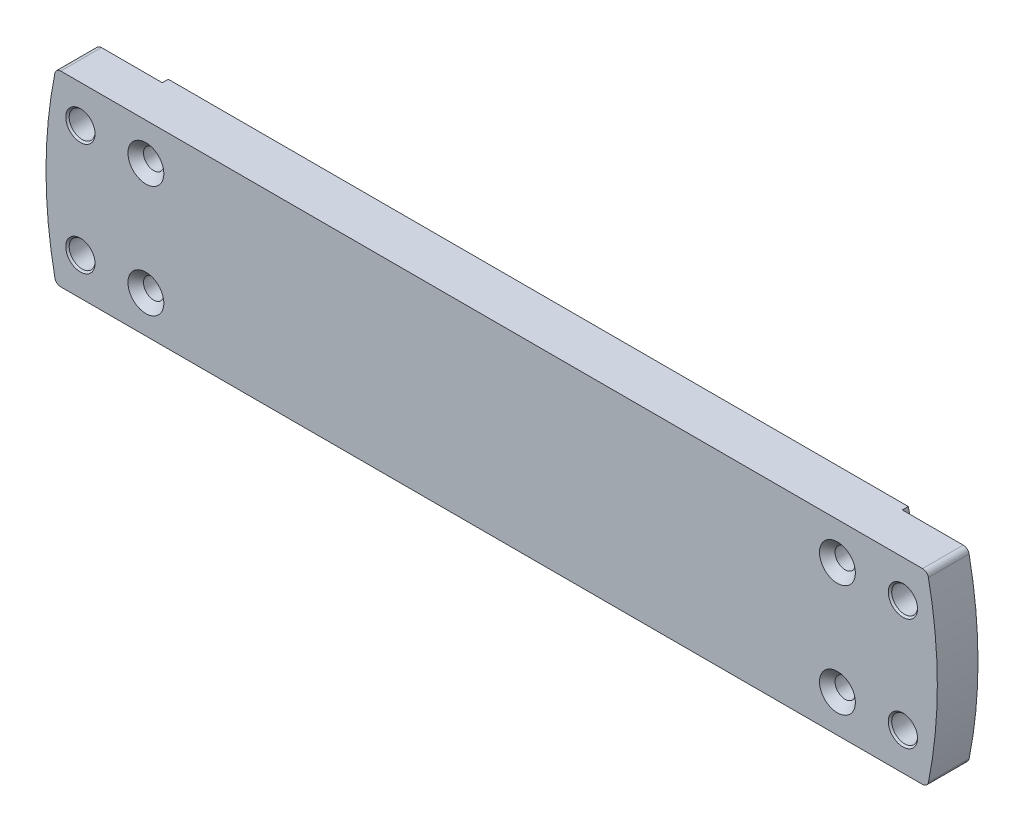
from build123d import *

# Parameters (mm, degrees)
BOSS_EXTRUDE1_DEPTH                  = 7.9248
SKETCH12_W                           = 35.56
SKETCH12_H                           = 35.56
FILLET1_R                            = 1.016
F_8_32_TAPPED_HOLE2_AT_2_COUNT       = 2
F_8_32_TAPPED_HOLE2_AT_2_PITCH       = 19.05
F_8_32_TAPPED_HOLE2_AT_3_COUNT       = 2
F_8_32_TAPPED_HOLE2_AT_3_PITCH       = 117.4496
F_8_32_TAPPED_HOLE2_AT_4_COUNT       = 2
F_8_32_TAPPED_HOLE2_AT_4_PITCH       = 118.984499159
F_17_0_173_DIAMETER_HOLE1_AT_2_COUNT = 2
F_17_0_173_DIAMETER_HOLE1_AT_2_PITCH = 19.05
F_17_0_173_DIAMETER_HOLE1_AT_3_COUNT = 2
F_17_0_173_DIAMETER_HOLE1_AT_3_PITCH = 139.7
F_17_0_173_DIAMETER_HOLE1_AT_4_COUNT = 2
F_17_0_173_DIAMETER_HOLE1_AT_4_PITCH = 140.992881026


with BuildPart() as part:
    # Sketch1 → Boss-Extrude1 (new body)
    with BuildSketch(Plane(origin=(0, 0, 0), x_dir=(1, 0, 0), z_dir=(0, 0, -1))):
        with BuildLine():
            Line((74.008534906, -15.875), (-74.008534906, -15.875))
            ThreePointArc((-74.008534906, -15.875), (-75.692, 0), (-74.008534906, 15.875))
            Line((-74.008534906, 15.875), (74.008534906, 15.875))
            ThreePointArc((74.008534906, 15.875), (75.692, 0), (74.008534906, -15.875))
        make_face()
    extrude(amount=-BOSS_EXTRUDE1_DEPTH)

    # Sketch12 → Cut-Revolve1 (revolve, cut)
    with BuildSketch(Plane(origin=(0, 0, 0), x_dir=(1, 0, 0), z_dir=(0, 1, 0))):
        with Locations((82.6008, 16.764)):
            Rectangle(SKETCH12_W, SKETCH12_H)
    revolve(axis=Axis((0, 0, -12.484857721), (0, 0, -1)), mode=Mode.SUBTRACT)

    # Fillet1
    fillet1_edges = [part.edges().sort_by_distance(p)[0] for p in [
        (74.008534906, 15.875, 4.4704),
        (-74.008534906, 15.875, 4.4704),
        (-74.008534906, -15.875, 4.4704),
        (74.008534906, -15.875, 4.4704),
    ]]
    fillet(fillet1_edges, radius=FILLET1_R)

    # Sketch2 → #8-32 Tapped Hole2 (revolve, cut)
    with BuildSketch(Plane(origin=(-58.7248, 9.525, 0), x_dir=(0, 1, 0), z_dir=(1, 0, 0))):
        Polygon((0, 0), (0, 7.9248), (3.048, 7.9248), (1.7272, 6.604), (1.7272, 0.5588), (2.286, 0), align=None)
    f_8_32_tapped_hole2 = revolve(axis=Axis((-58.7248, 9.525, -6.35), (0, 0, 1)), mode=Mode.SUBTRACT)

    # #8-32 Tapped Hole2 at 2: #8-32 Tapped Hole2 ×2
    with Locations(*[(0, -i * F_8_32_TAPPED_HOLE2_AT_2_PITCH, 0) for i in range(1, F_8_32_TAPPED_HOLE2_AT_2_COUNT)]):
        add(f_8_32_tapped_hole2, mode=Mode.SUBTRACT)

    # #8-32 Tapped Hole2 at 3: #8-32 Tapped Hole2 ×2
    with Locations(*[(i * F_8_32_TAPPED_HOLE2_AT_3_PITCH, 0, 0) for i in range(1, F_8_32_TAPPED_HOLE2_AT_3_COUNT)]):
        add(f_8_32_tapped_hole2, mode=Mode.SUBTRACT)

    # #8-32 Tapped Hole2 at 4: #8-32 Tapped Hole2 ×2
    with Locations(*[Vector(0.9871000073957296, -0.16010488874281947, 0) * (i * F_8_32_TAPPED_HOLE2_AT_4_PITCH) for i in range(1, F_8_32_TAPPED_HOLE2_AT_4_COUNT)]):
        add(f_8_32_tapped_hole2, mode=Mode.SUBTRACT)

    # Sketch5 → #17 (0.173) Diameter Hole1 (revolve, cut)
    with BuildSketch(Plane(origin=(69.85, 9.525, 7.9248), x_dir=(0, -1, 0), z_dir=(1, 0, 0))):
        Polygon((0, 0), (0, 6.9088), (2.4892, 6.9088), (2.1971, 6.6167), (2.1971, 0.2921), (2.4892, 0), align=None)
    f_17_0_173_diameter_hole1 = revolve(axis=Axis((69.85, 9.525, 14.2748), (0, 0, -1)), mode=Mode.SUBTRACT)

    # #17 (0.173) Diameter Hole1 at 2: #17 (0.173) Diameter Hole1 ×2
    with Locations(*[(0, -i * F_17_0_173_DIAMETER_HOLE1_AT_2_PITCH, 0) for i in range(1, F_17_0_173_DIAMETER_HOLE1_AT_2_COUNT)]):
        add(f_17_0_173_diameter_hole1, mode=Mode.SUBTRACT)

    # #17 (0.173) Diameter Hole1 at 3: #17 (0.173) Diameter Hole1 ×2
    with Locations(*[(-i * F_17_0_173_DIAMETER_HOLE1_AT_3_PITCH, 0, 0) for i in range(1, F_17_0_173_DIAMETER_HOLE1_AT_3_COUNT)]):
        add(f_17_0_173_diameter_hole1, mode=Mode.SUBTRACT)

    # #17 (0.173) Diameter Hole1 at 4: #17 (0.173) Diameter Hole1 ×2
    with Locations(*[Vector(-0.990830168044299, -0.13511320473331354, 0) * (i * F_17_0_173_DIAMETER_HOLE1_AT_4_PITCH) for i in range(1, F_17_0_173_DIAMETER_HOLE1_AT_4_COUNT)]):
        add(f_17_0_173_diameter_hole1, mode=Mode.SUBTRACT)


solid = part.part
